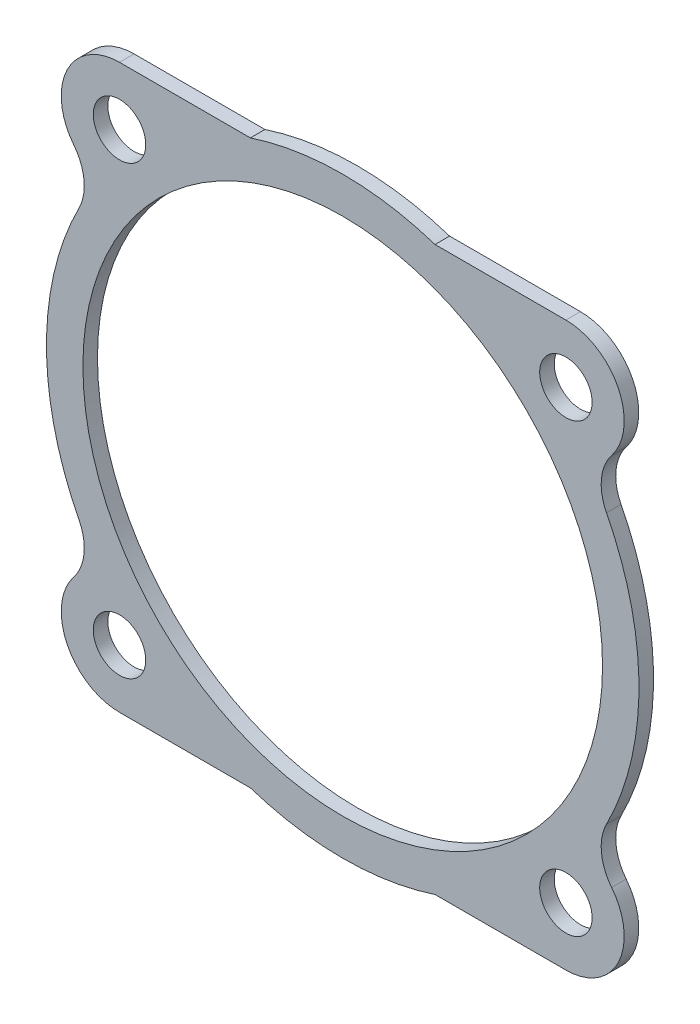
from build123d import *

# Parameters (mm, degrees)
ESQUISSE1_R          = 13.375
ESQUISSE1_R_2        = 1.35
BASE_EXTRUSION_DEPTH = 0.75


with BuildPart() as part:
    # Esquisse1 → Base-Extrusion (new body)
    with BuildSketch(Plane.XY):
        with BuildLine():
            Line((-4.752719099, 14.490485194), (-11.490485194, 14.490485194))
            ThreePointArc((-11.490485194, 14.490485194), (-14.190687351, 12.797737393), (-13.843715332, 9.629757402))
            ThreePointArc((-13.843715332, 9.629757402), (-13.316796605, 8.324376183), (-13.578720666, 6.941242329))
            ThreePointArc((-13.578720666, 6.941242329), (-14.258481428, 5.409085631), (-14.765986011, 3.811581971))
            ThreePointArc((-14.765986011, 3.811581971), (-14.96384856, 2.940363289), (-15.110354082, 2.059053064))
            ThreePointArc((-15.110354082, 2.059053064), (-15.215048468, 1.031891528), (-15.25, 0))
            ThreePointArc((-15.25, 0), (-14.826294044, -3.569804606), (-13.578720666, -6.941242329))
            ThreePointArc((-13.578720666, -6.941242329), (-13.316796605, -8.324376183), (-13.843715332, -9.629757402))
            ThreePointArc((-13.843715332, -9.629757402), (-14.190687351, -12.797737393), (-11.490485194, -14.490485194))
            Line((-11.490485194, -14.490485194), (-4.752719099, -14.490485194))
            ThreePointArc((-4.752719099, -14.490485194), (0, -15.25), (4.752719099, -14.490485194))
            Line((4.752719099, -14.490485194), (11.490485194, -14.490485194))
            ThreePointArc((11.490485194, -14.490485194), (14.190687351, -12.797737393), (13.843715332, -9.629757402))
            ThreePointArc((13.843715332, -9.629757402), (13.316796605, -8.324376183), (13.578720666, -6.941242329))
            ThreePointArc((13.578720666, -6.941242329), (15.25, 0), (13.578720666, 6.941242329))
            ThreePointArc((13.578720666, 6.941242329), (13.316796605, 8.324376183), (13.843715332, 9.629757402))
            ThreePointArc((13.843715332, 9.629757402), (14.190687351, 12.797737393), (11.490485194, 14.490485194))
            Line((11.490485194, 14.490485194), (4.752719099, 14.490485194))
            ThreePointArc((4.752719099, 14.490485194), (2.406512081, 15.058924251), (0, 15.25))
            ThreePointArc((0, 15.25), (-2.406512081, 15.058924251), (-4.752719099, 14.490485194))
        make_face()
        Circle(ESQUISSE1_R, mode=Mode.SUBTRACT)
        with Locations((-11.490485194, -11.490485194)):
            Circle(ESQUISSE1_R_2, mode=Mode.SUBTRACT)
        with Locations((-11.490485194, 11.490485194)):
            Circle(ESQUISSE1_R_2, mode=Mode.SUBTRACT)
        with Locations((11.490485194, 11.490485194)):
            Circle(ESQUISSE1_R_2, mode=Mode.SUBTRACT)
        with Locations((11.490485194, -11.490485194)):
            Circle(ESQUISSE1_R_2, mode=Mode.SUBTRACT)
    extrude(amount=BASE_EXTRUSION_DEPTH)


solid = part.part
